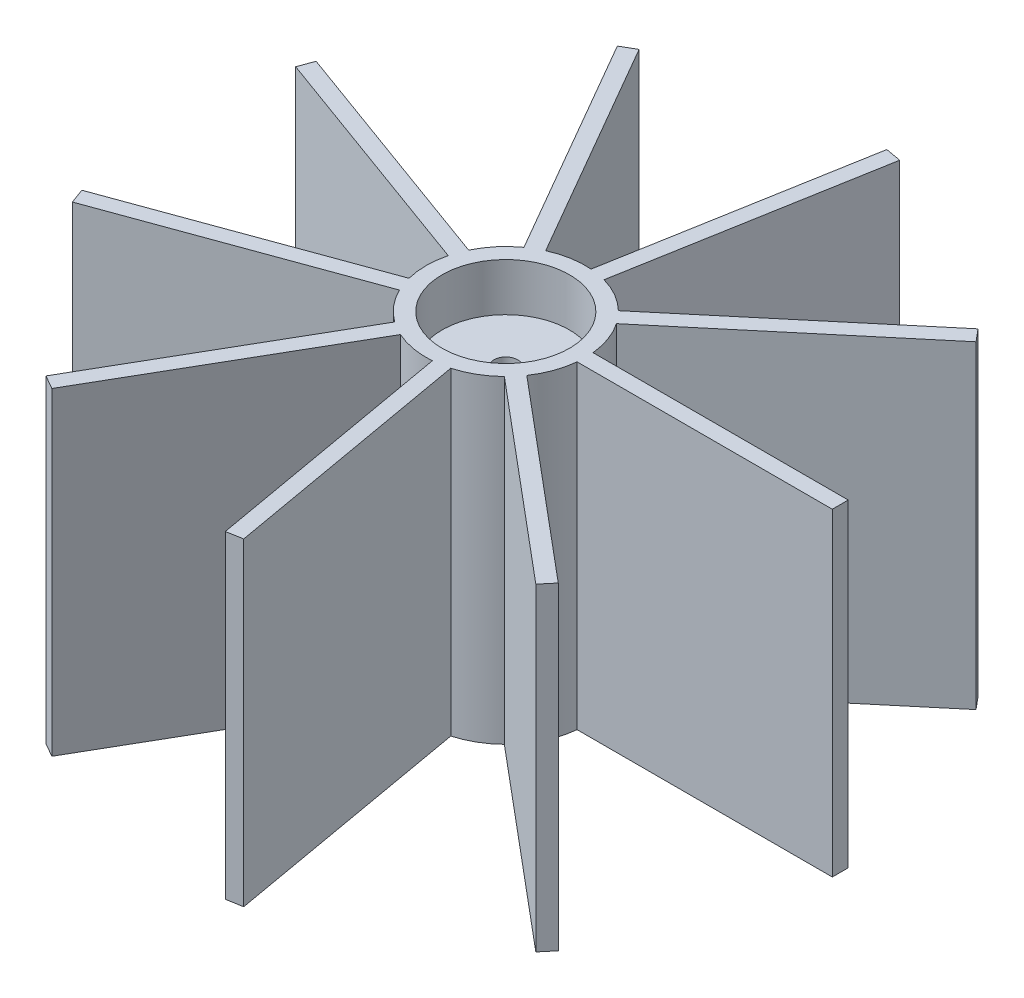
from build123d import *

# Parameters (mm, degrees)
SKETCH1_R           = 5
SKETCH1_R_2         = 3
BOSS_EXTRUDE2_DEPTH = 17.5
SKETCH4_W           = 18
SKETCH4_H           = 1
EXTRUDE_THIN1_DEPTH = 35
CIRPATTERN1_COUNT   = 9
SKETCH5_R           = 3
BOSS_EXTRUDE3_DEPTH = 15
SKETCH6_R           = 3.5
SKETCH6_R_2         = 1.5
CUT_EXTRUDE1_DEPTH  = 6
SKETCH15_R          = 1.5
CUT_EXTRUDE2_DEPTH  = 2
SKETCH17_R          = 2.5
BOSS_EXTRUDE4_DEPTH = 3
SKETCH18_R          = 2
CUT_EXTRUDE3_DEPTH  = 2
SKETCH19_R          = 4
CUT_EXTRUDE4_DEPTH  = 20
SKETCH20_W          = 45.677284088
SKETCH20_H          = 45.724664858
CUT_EXTRUDE5_DEPTH  = 8
SKETCH21_R          = 3
BOSS_EXTRUDE5_DEPTH = 1
SKETCH24_R          = 9.912143672
BOSS_EXTRUDE6_DEPTH = 0.5
SKETCH25_R          = 3.2
CUT_EXTRUDE6_DEPTH  = 2.1
SKETCH26_R          = 3.2
BOSS_EXTRUDE7_DEPTH = 0.25
CUT_EXTRUDE8_START  = -7.5
CUT_EXTRUDE8_DEPTH  = 7.5
SKETCH28_R          = 0.5
CUT_EXTRUDE9_DEPTH  = 1.5
CUT_EXTRUDE10_DEPTH = 7
BOSS_EXTRUDE8_START = 10
SKETCH30_R          = 4
BOSS_EXTRUDE8_DEPTH = 10
SKETCH33_R          = 18.064901356
CUT_EXTRUDE13_DEPTH = 20
SKETCH34_R          = 3
CUT_EXTRUDE14_DEPTH = 8.5
SKETCH35_R          = 0.75
CUT_EXTRUDE16_DEPTH = 3


with BuildPart() as part:
    # Sketch1 → Boss-Extrude2 (new, symmetric)
    with BuildSketch(Plane(origin=(0, 0, 0), x_dir=(1, 0, 0), z_dir=(0, 1, 0))):
        with Locations(Location((0, 0, 0), (0, 0, 270))):
            Circle(SKETCH1_R)
        with Locations(Location((0, 0, 0), (0, 0, 270))):
            Circle(SKETCH1_R_2, mode=Mode.SUBTRACT)
    extrude(amount=BOSS_EXTRUDE2_DEPTH, both=True)

    # Sketch4 → Extrude-Thin1 (add)
    with BuildSketch(Plane(origin=(0, 17.5, 0), x_dir=(1, 0, 0), z_dir=(0, 1, 0))):
        with Locations((12, 0)):
            Rectangle(SKETCH4_W, SKETCH4_H)
    extrude_thin1 = extrude(amount=-EXTRUDE_THIN1_DEPTH)

    # CirPattern1: Extrude-Thin1 ×9 about axis
    cirpattern1_axis = Axis((0, 0, 0), (0, 1, 0))
    for i in range(1, CIRPATTERN1_COUNT):
        add(extrude_thin1.rotate(cirpattern1_axis, i * 360 / CIRPATTERN1_COUNT))

    # Sketch5 → Boss-Extrude3 (add)
    with BuildSketch(Plane(origin=(0, -17.5, 0), x_dir=(-1, 0, 0), z_dir=(0, -1, 0))):
        with Locations(Location((0, 0, 0), (0, 0, 90))):
            Circle(SKETCH5_R)
    extrude(amount=-BOSS_EXTRUDE3_DEPTH)

    # Sketch6 → Cut-Extrude1 (cut)
    with BuildSketch(Plane(origin=(0, -17.5, 0), x_dir=(-1, 0, 0), z_dir=(0, -1, 0))):
        with Locations(Location((0, 0, 0), (0, 0, 90))):
            Circle(SKETCH6_R)
        with Locations(Location((0, 0, 0), (0, 0, 90))):
            Circle(SKETCH6_R_2, mode=Mode.SUBTRACT)
    extrude(amount=-CUT_EXTRUDE1_DEPTH, mode=Mode.SUBTRACT)

    # Sketch15 → Cut-Extrude2 (cut)
    with BuildSketch(Plane.XZ.offset(17.5)):
        with Locations(Location((0, 0, 0), (0, 0, 270))):
            Circle(SKETCH15_R)
    extrude(amount=-CUT_EXTRUDE2_DEPTH, mode=Mode.SUBTRACT)

    # Sketch17 → Boss-Extrude4 (add)
    with BuildSketch(Plane.XZ.offset(17.5)):
        with Locations((18.5, 0)):
            Circle(SKETCH17_R)
    extrude(amount=-BOSS_EXTRUDE4_DEPTH)

    # Sketch18 → Cut-Extrude3 (cut)
    with BuildSketch(Plane.XZ.offset(17.5)):
        with Locations(Location((18.5, 0, 0), (0, 0, 270))):
            Circle(SKETCH18_R)
    extrude(amount=-CUT_EXTRUDE3_DEPTH, mode=Mode.SUBTRACT)

    # Sketch19 → Cut-Extrude4 (cut)
    with BuildSketch(Plane(origin=(0, 17.5, 0), x_dir=(1, 0, 0), z_dir=(0, 1, 0))):
        with Locations(Location((0, 0, 0), (0, 0, 270))):
            Circle(SKETCH19_R)
    extrude(amount=-CUT_EXTRUDE4_DEPTH, mode=Mode.SUBTRACT)

    # Sketch20 → Cut-Extrude5 (cut)
    with BuildSketch(Plane(origin=(0, -17.5, 0), x_dir=(-1, 0, 0), z_dir=(0, -1, 0))):
        Rectangle(SKETCH20_W, SKETCH20_H)
    extrude(amount=-CUT_EXTRUDE5_DEPTH, mode=Mode.SUBTRACT)

    # Sketch21 → Boss-Extrude5 (add)
    with BuildSketch(Plane.XZ.offset(9.5)):
        with Locations(Location((0, 0, 0), (0, 0, 90))):
            Circle(SKETCH21_R)
    extrude(amount=BOSS_EXTRUDE5_DEPTH)

    # Sketch23 → Revolve1 (revolve)
    with BuildSketch(Plane(origin=(0, 0, 0), x_dir=(0, 0, -1), z_dir=(1, 0, 0))):
        with BuildLine():
            Line((-3, -10.5), (-2, -10.5))
            Line((-2, -10.5), (0, -10.5))
            Line((0, -10.5), (0, -17.5))
            Line((0, -17.5), (-8.912143672, -17.5))
            Line((-8.912143672, -17.5), (-9.912143672, -17.5))
            ThreePointArc((-9.912143672, -17.5), (-7.260403323, -13.2057636), (-3, -10.5))
        make_face()
    revolve(axis=Axis((0, -11.130650603, 0), (0, -1, 0)))

    # Sketch24 → Boss-Extrude6 (add)
    with BuildSketch(Plane.XZ.offset(17.5)):
        with Locations(Location((0, 0, 0), (0, 0, 270))):
            Circle(SKETCH24_R)
    extrude(amount=BOSS_EXTRUDE6_DEPTH)

    # Sketch25 → Cut-Extrude6 (cut)
    with BuildSketch(Plane.XZ.offset(18)):
        with Locations(Location((-0.56668442, 5, 0), (0, 0, 270))):
            Circle(SKETCH25_R)
    extrude(amount=-CUT_EXTRUDE6_DEPTH, mode=Mode.SUBTRACT)

    # Sketch26 → Boss-Extrude7 (add)
    with BuildSketch(Plane.XZ.offset(18)):
        with Locations(Location((-0.56668442, 5, 0), (0, 0, 270))):
            Circle(SKETCH26_R)
    extrude(amount=-BOSS_EXTRUDE7_DEPTH)

    # Sketch27 → Cut-Extrude8 (cut)
    with BuildSketch(Plane.XZ.offset(18).offset(CUT_EXTRUDE8_START)):
        with BuildLine():
            ThreePointArc((-5.368630905, 4.991892601), (-6.424807204, 5.779358473), (-7.613826501, 6.346671425))
            ThreePointArc((-7.613826501, 6.346671425), (-9.912143672, 0), (-7.613826501, -6.346671425))
            ThreePointArc((-7.613826501, -6.346671425), (-6.424807204, -5.779358473), (-5.368630905, -4.991892601))
            ThreePointArc((-5.368630905, -4.991892601), (-3.162143672, 0), (-5.368630905, 4.991892601))
        make_face()
        with BuildLine():
            ThreePointArc((9.912143672, 0), (9.319869483, 3.375), (7.613826501, 6.346671425))
            ThreePointArc((7.613826501, 6.346671425), (6.424807204, 5.779358473), (5.368630905, 4.991892601))
            ThreePointArc((5.368630905, 4.991892601), (3.162143672, 0), (5.368630905, -4.991892601))
            ThreePointArc((5.368630905, -4.991892601), (6.424807204, -5.779358473), (7.613826501, -6.346671425))
            ThreePointArc((7.613826501, -6.346671425), (9.319869483, -3.375), (9.912143672, 0))
        make_face()
        with BuildLine():
            ThreePointArc((-5.368630905, -4.991892601), (-6.424807204, -5.779358473), (-7.613826501, -6.346671425))
            ThreePointArc((-7.613826501, -6.346671425), (-4.203657524, -8.976628297), (0, -9.912143672))
            add(Edge.make_bspline(
                [(-5.368630905, -4.991892601), (-4.998119196, -7.539682857), (-2.616364035, -9.837937814), (0, -9.912143672)],
                knots=[0, 0, 0, 0, 1, 1, 1, 1], degree=3))
        make_face()
        with BuildLine():
            add(Edge.make_bspline(
                [(5.368630905, -4.991892601), (4.998119196, -7.539682857), (2.616364035, -9.837937814), (0, -9.912143672)],
                knots=[0, 0, 0, 0, 1, 1, 1, 1], degree=3))
            ThreePointArc((0, -9.912143672), (4.203657524, -8.976628297), (7.613826501, -6.346671425))
            ThreePointArc((7.613826501, -6.346671425), (6.424807204, -5.779358473), (5.368630905, -4.991892601))
        make_face()
        with BuildLine():
            ThreePointArc((0, 9.912143672), (-4.203657524, 8.976628297), (-7.613826501, 6.346671425))
            ThreePointArc((-7.613826501, 6.346671425), (-6.424807204, 5.779358473), (-5.368630905, 4.991892601))
            add(Edge.make_bspline(
                [(-5.368630905, 4.991892601), (-4.998119196, 7.539682857), (-2.616364035, 9.837937814), (0, 9.912143672)],
                knots=[0, 0, 0, 0, 1, 1, 1, 1], degree=3))
        make_face()
        with BuildLine():
            ThreePointArc((7.613826501, 6.346671425), (4.203657524, 8.976628297), (0, 9.912143672))
            add(Edge.make_bspline(
                [(5.368630905, 4.991892601), (4.998119196, 7.539682857), (2.616364035, 9.837937814), (0, 9.912143672)],
                knots=[0, 0, 0, 0, 1, 1, 1, 1], degree=3))
            ThreePointArc((5.368630905, 4.991892601), (6.424807204, 5.779358473), (7.613826501, 6.346671425))
        make_face()
    extrude(amount=CUT_EXTRUDE8_DEPTH, mode=Mode.SUBTRACT)

    # Sketch28 → Cut-Extrude9 (cut)
    with BuildSketch(Plane.XZ.offset(18)):
        with Locations(Location((0, 0, 0), (0, 0, 270))):
            Circle(SKETCH28_R)
    extrude(amount=-CUT_EXTRUDE9_DEPTH, mode=Mode.SUBTRACT)

    # Sketch29 → Cut-Extrude10 (cut)
    with BuildSketch(Plane(origin=(0, 17.5, 0), x_dir=(1, 0, 0), z_dir=(0, 1, 0))):
        with BuildLine():
            Line((3.489629181, -3.580850203), (15.765539501, -13.881562025))
            Line((15.765539501, -13.881562025), (16.40832711, -13.115517582))
            Line((16.40832711, -13.115517582), (4.132416791, -2.81480576))
            ThreePointArc((4.132416791, -2.81480576), (4.698463104, -1.710100717), (4.974937186, -0.5))
            Line((4.974937186, -0.5), (21, -0.5))
            Line((21, -0.5), (21, 0.5))
            Line((21, 0.5), (4.974937186, 0.5))
            ThreePointArc((4.974937186, 0.5), (4.698463104, 1.710100717), (4.132416791, 2.81480576))
            Line((4.132416791, 2.81480576), (16.40832711, 13.115517582))
            Line((16.40832711, 13.115517582), (15.765539501, 13.881562025))
            Line((15.765539501, 13.881562025), (3.489629181, 3.580850203))
            ThreePointArc((3.489629181, 3.580850203), (2.5, 4.330127019), (1.356292653, 4.812532622))
            Line((1.356292653, 4.812532622), (4.139015608, 20.594138724))
            Line((4.139015608, 20.594138724), (3.154207854, 20.767786902))
            Line((3.154207854, 20.767786902), (0.3714849, 4.9861808))
            ThreePointArc((0.3714849, 4.9861808), (-0.868240888, 4.924038765), (-2.054455891, 4.558421985))
            Line((-2.054455891, 4.558421985), (-10.066987298, 18.436533479))
            Line((-10.066987298, 18.436533479), (-10.933012702, 17.936533479))
            Line((-10.933012702, 17.936533479), (-2.920481295, 4.058421985))
            ThreePointArc((-2.920481295, 4.058421985), (-3.830222216, 3.213938048), (-4.50390169, 2.17137504))
            Line((-4.50390169, 2.17137504), (-19.562534965, 7.65226932))
            Line((-19.562534965, 7.65226932), (-19.904555108, 6.712576699))
            Line((-19.904555108, 6.712576699), (-4.845921834, 1.231682419))
            ThreePointArc((-4.845921834, 1.231682419), (-5, 0), (-4.845921834, -1.231682419))
            Line((-4.845921834, -1.231682419), (-19.904555108, -6.712576699))
            Line((-19.904555108, -6.712576699), (-19.562534965, -7.65226932))
            Line((-19.562534965, -7.65226932), (-4.50390169, -2.17137504))
            ThreePointArc((-4.50390169, -2.17137504), (-3.830222216, -3.213938048), (-2.920481295, -4.058421985))
            Line((-2.920481295, -4.058421985), (-10.933012702, -17.936533479))
            Line((-10.933012702, -17.936533479), (-10.066987298, -18.436533479))
            Line((-10.066987298, -18.436533479), (-2.054455891, -4.558421985))
            ThreePointArc((-2.054455891, -4.558421985), (-0.868240888, -4.924038765), (0.3714849, -4.9861808))
            Line((0.3714849, -4.9861808), (3.154207854, -20.767786902))
            Line((3.154207854, -20.767786902), (4.139015608, -20.594138724))
            Line((4.139015608, -20.594138724), (1.356292653, -4.812532622))
            ThreePointArc((1.356292653, -4.812532622), (2.5, -4.330127019), (3.489629181, -3.580850203))
        make_face()
    extrude(amount=-CUT_EXTRUDE10_DEPTH, mode=Mode.SUBTRACT)

    # Sketch30 → Boss-Extrude8 (add)
    with BuildSketch(Plane(origin=(0, -2.5, 0), x_dir=(1, 0, 0), z_dir=(0, 1, 0)).offset(BOSS_EXTRUDE8_START)):
        with Locations(Location((0, 0, 0), (0, 0, 270))):
            Circle(SKETCH30_R)
    extrude(amount=-BOSS_EXTRUDE8_DEPTH)

    # Sketch33 → Cut-Extrude13 (cut)
    with BuildSketch(Plane.XZ.offset(9.5)):
        Circle(SKETCH33_R)
    extrude(amount=CUT_EXTRUDE13_DEPTH, mode=Mode.SUBTRACT)

    # Sketch34 → Cut-Extrude14 (cut)
    with BuildSketch(Plane.XZ.offset(9.5)):
        with Locations(Location((0, 0, 0), (0, 0, 270))):
            Circle(SKETCH34_R)
    extrude(amount=-CUT_EXTRUDE14_DEPTH, mode=Mode.SUBTRACT)

    # Sketch35 → Cut-Extrude16 (cut)
    with BuildSketch(Plane(origin=(0, 7.5, 0), x_dir=(1, 0, 0), z_dir=(0, 1, 0))):
        with Locations(Location((0, 0, 0), (0, 0, 270))):
            Circle(SKETCH35_R)
    extrude(amount=-CUT_EXTRUDE16_DEPTH, mode=Mode.SUBTRACT)


solid = part.part
